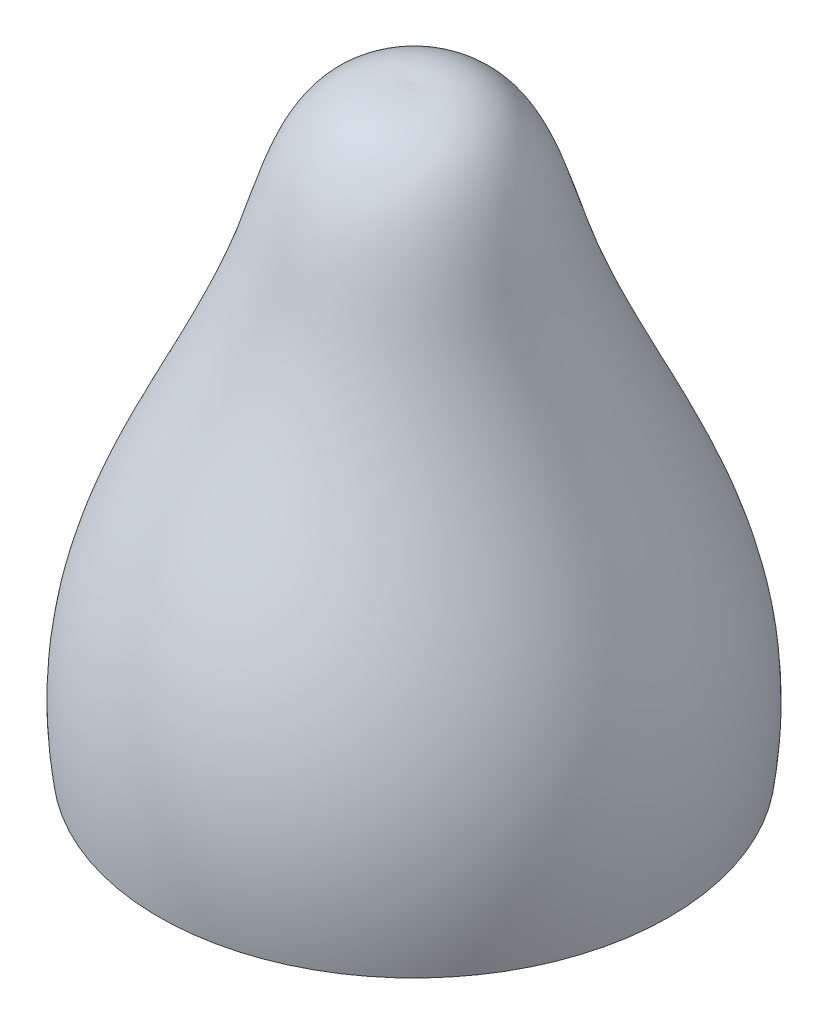
from build123d import *

# Parameters (mm, degrees)
SKETCH3_R          = 1.5
CUT_EXTRUDE1_DEPTH = 4


with BuildPart() as part:
    # Sketch2 → Revolve1 (revolve)
    with BuildSketch(Plane.XY):
        with BuildLine():
            Line((0, 0), (0, 7))
            add(Edge.make_bspline(
                [(0, 7), (1.068178014, 7.111487526), (1.578453493, 3.96435304), (3.313346516, 2.221976179), (3, 0)],
                knots=[0, 0, 0, 0, 0.308743413, 1, 1, 1, 1], degree=3))
            Line((3, 0), (0, 0))
        make_face()
    revolve(axis=Axis((0, 0, 0), (0, 1, 0)))

    # Sketch3 → Cut-Extrude1 (cut)
    with BuildSketch(Plane.XZ):
        with Locations(Location((0, 0, 0), (0, 0, 270))):
            Circle(SKETCH3_R)
    extrude(amount=-CUT_EXTRUDE1_DEPTH, mode=Mode.SUBTRACT)


solid = part.part
